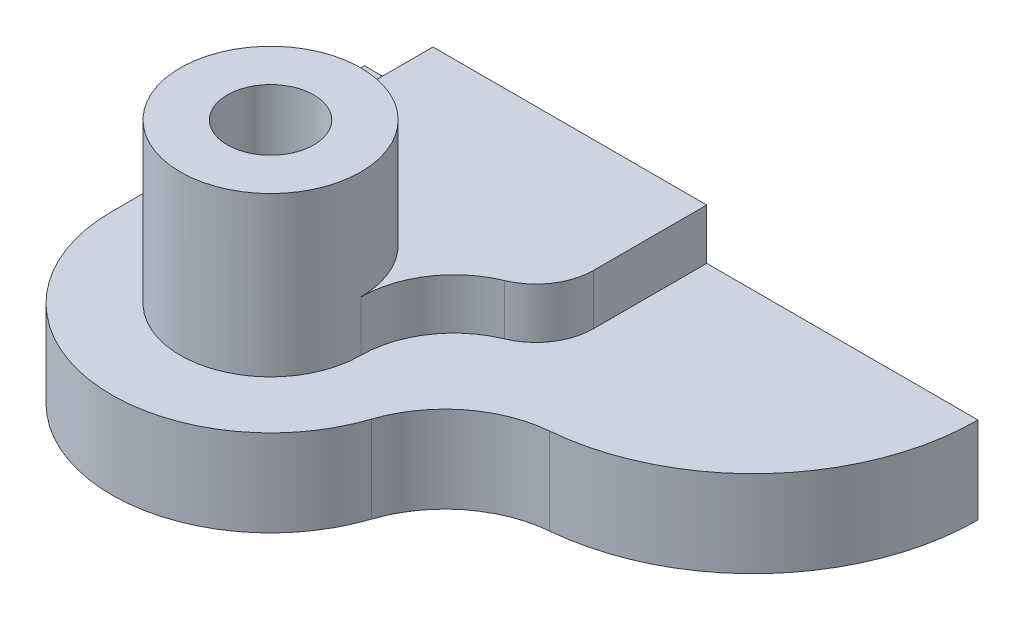
from build123d import *

# Parameters (mm, degrees)
BOSS_EXTRUDE1_DEPTH = 12
BOSS_EXTRUDE2_DEPTH = 19
SKETCH1_4_R         = 6
BOSS_EXTRUDE3_DEPTH = 34


with BuildPart() as part:
    # Sketch1 → Boss-Extrude1 (new body)
    with BuildSketch(Plane(origin=(0, 0, 0), x_dir=(1, 0, 0), z_dir=(0, 1, 0))):
        with BuildLine():
            Line((-22, 35), (-22, 0))
            ThreePointArc((-22, 0), (-3.499816256, -21.719836237), (20.886480561, -6.910494177))
            ThreePointArc((20.886480561, -6.910494177), (26.137546313, 0.602202667), (34.650435288, 4))
            ThreePointArc((34.650435288, 4), (54.843960905, 13.995846724), (63, 35))
            Line((63, 35), (25.421858315, 35))
            Line((25.421858315, 35), (25.421858315, 19.331946497))
            ThreePointArc((25.421858315, 19.331946497), (24.072873785, 14.886275206), (20.480860008, 11.939889365))
            ThreePointArc((20.480860008, 11.939889365), (14.678923372, 7.180791818), (12.5, 0))
            ThreePointArc((12.5, 0), (0, -12.5), (-12.5, 0))
            Line((-12.5, 0), (-12.5, 35))
            Line((-12.5, 35), (-22, 35))
        make_face()
    extrude(amount=BOSS_EXTRUDE1_DEPTH)

    # Sketch1<3> → Boss-Extrude2 (add)
    with BuildSketch(Plane(origin=(0, 0, 0), x_dir=(1, 0, 0), z_dir=(0, 1, 0))):
        with BuildLine():
            Line((25.421858315, 35), (-12.5, 35))
            Line((-12.5, 35), (-12.5, 0))
            ThreePointArc((-12.5, 0), (0, 12.5), (12.5, 0))
            ThreePointArc((12.5, 0), (14.678923372, 7.180791818), (20.480860008, 11.939889365))
            ThreePointArc((20.480860008, 11.939889365), (24.072873785, 14.886275206), (25.421858315, 19.331946497))
            Line((25.421858315, 19.331946497), (25.421858315, 35))
        make_face()
    extrude(amount=BOSS_EXTRUDE2_DEPTH)

    # Sketch1<4> → Boss-Extrude3 (add)
    with BuildSketch(Plane(origin=(0, 0, 0), x_dir=(1, 0, 0), z_dir=(0, 1, 0))):
        with BuildLine():
            ThreePointArc((12.5, 0), (0, 12.5), (-12.5, 0))
            ThreePointArc((-12.5, 0), (0, -12.5), (12.5, 0))
        make_face()
        Circle(SKETCH1_4_R, mode=Mode.SUBTRACT)
    extrude(amount=BOSS_EXTRUDE3_DEPTH)


solid = part.part
